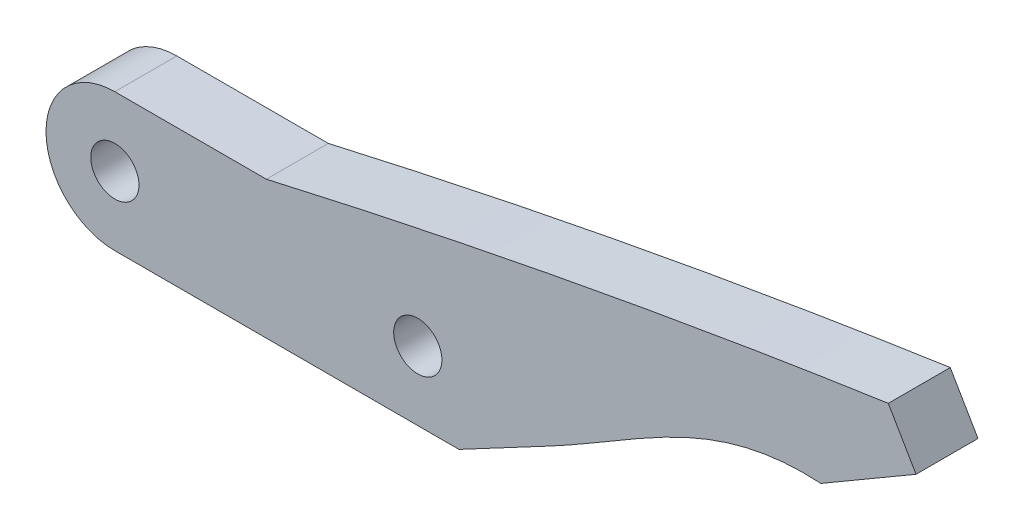
from build123d import *

# Parameters (mm, degrees)
SKETCH1_R           = 1.75
BOSS_EXTRUDE1_DEPTH = 4.5
BOSS_EXTRUDE2_START = -4.5
BOSS_EXTRUDE2_DEPTH = 4.5


with BuildPart() as part:
    # Sketch1 → Boss-Extrude1 (new body)
    with BuildSketch(Plane.XY):
        with BuildLine():
            ThreePointArc((-11, 5), (-16, 0), (-11, -5))
            Line((-11, -5), (11.000000019, -5))
            ThreePointArc((11.000000019, -5), (16, 9e-09), (11, 5))
            Line((11, 5), (-11, 5))
        make_face()
        with Locations((-11, 0)):
            Circle(SKETCH1_R, mode=Mode.SUBTRACT)
        with Locations((11, 0)):
            Circle(SKETCH1_R, mode=Mode.SUBTRACT)
    extrude(amount=BOSS_EXTRUDE1_DEPTH)

    # Sketch2 → Boss-Extrude2 (add)
    with BuildSketch(Plane.XY.offset(4.5).offset(BOSS_EXTRUDE2_START)):
        with BuildLine():
            Line((47.182162457, 10.03), (45.167162457, 13.485397951))
            add(Edge.make_bspline(
                [(0, 5), (22.415618243, 10.14564432), (45.167162457, 13.485397951)],
                knots=[0, 0, 0, 1, 1, 1], degree=2))
            Line((0, 5), (11, 5))
            ThreePointArc((11, 5), (16, 0), (11, -5))
            Line((11, -5), (13.99, -5))
            Line((13.99, -5), (20.61, -1.48))
            add(Edge.make_bspline(
                [(40.271366555, 6), (32.419293016, 6.4877302), (27.171947838, 2.009132385), (20.61, -1.48)],
                knots=[0, 0, 0, 0, 1, 1, 1, 1], degree=3))
            Line((40.271366555, 6), (47.182162457, 10.03))
        make_face()
    extrude(amount=BOSS_EXTRUDE2_DEPTH)


solid = part.part
